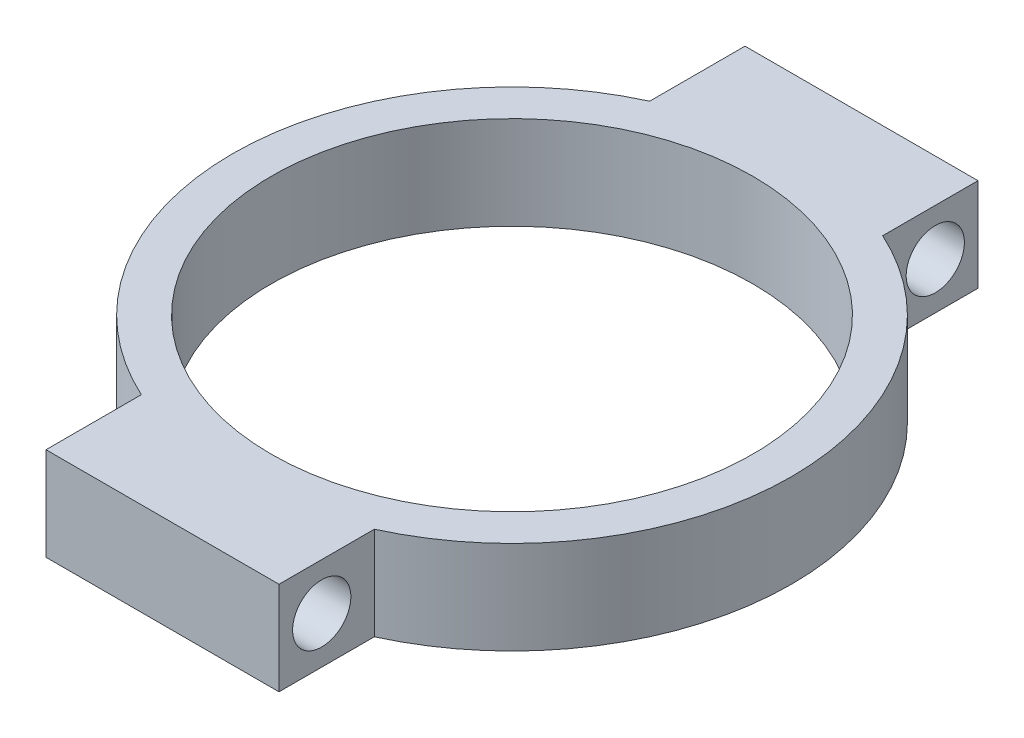
from build123d import *

# Parameters (mm, degrees)
SKETCH1_R           = 39.37
BOSS_EXTRUDE1_DEPTH = 15.24
SKETCH2_R           = 4.7625
CUT_EXTRUDE1_DEPTH  = 88.712786981


with BuildPart() as part:
    # Sketch1 → Boss-Extrude1 (new body)
    with BuildSketch(Plane(origin=(0, 0, 0), x_dir=(1, 0, 0), z_dir=(0, 1, 0))):
        with BuildLine():
            Line((-19.05, 57.15), (19.05, 57.15))
            Line((19.05, 57.15), (19.05, 41.562193157))
            ThreePointArc((19.05, 41.562193157), (45.72, 0), (19.05, -41.562193157))
            Line((19.05, -41.562193157), (19.05, -57.15))
            Line((19.05, -57.15), (-19.05, -57.15))
            Line((-19.05, -57.15), (-19.05, -41.562193157))
            ThreePointArc((-19.05, -41.562193157), (-45.72, 0), (-19.05, 41.562193157))
            Line((-19.05, 41.562193157), (-19.05, 57.15))
        make_face()
        with Locations(Location((0, 0, 0), (0, 0, 90))):
            Circle(SKETCH1_R, mode=Mode.SUBTRACT)
    extrude(amount=BOSS_EXTRUDE1_DEPTH)

    # Sketch2 → Cut-Extrude1 (cut, through all)
    with BuildSketch(Plane.ZY.offset(19.05)):
        with BuildLine():
            ThreePointArc((45.4025, 7.62), (50.165, 2.8575), (54.9275, 7.62))
            Line((54.9275, 7.62), (45.4025, 7.62))
        make_face()
        with BuildLine():
            Line((45.4025, 7.62), (54.9275, 7.62))
            ThreePointArc((54.9275, 7.62), (50.165, 12.3825), (45.4025, 7.62))
        make_face()
        with Locations((-50.165, 7.62)):
            Circle(SKETCH2_R)
    extrude(amount=-CUT_EXTRUDE1_DEPTH, mode=Mode.SUBTRACT)


solid = part.part
